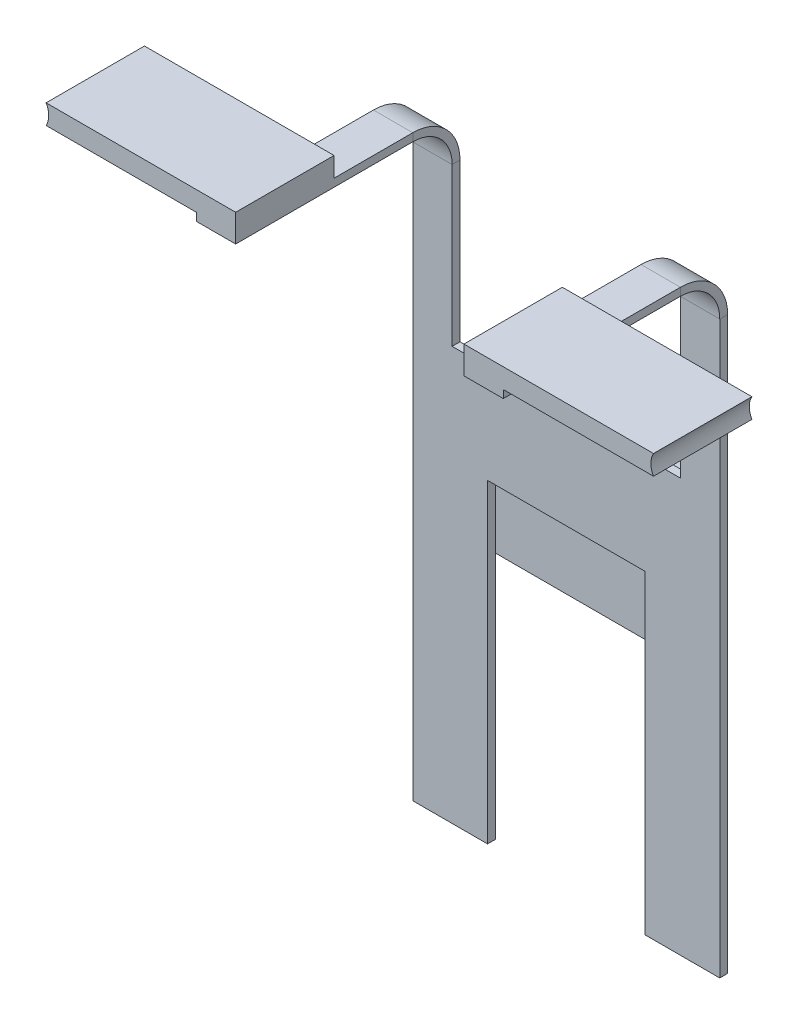
from build123d import *

# Parameters (mm, degrees)
EXTRUDE_1_DEPTH     = 4
SKETCH_2_W          = 100
SKETCH_2_H          = 72
EXTRUDE_2_DEPTH     = 20
SKETCH_4_W          = 20
SKETCH_4_H          = 4
SKETCH_7_W          = 50
SKETCH_7_H          = 10
SKETCH_9_W          = 50
SKETCH_9_H          = 10
SKETCH_12_R         = 10
CUT_EXTRUDE_1_DEPTH = 265.227174984


with BuildPart() as part:
    # 草图1 → 凸台-拉伸1 (new body)
    with BuildSketch(Plane.XY):
        Polygon((-40, 0), (40, 0), (40, -160), (78, -160), (78, 0), (78, 50), (-78, 50), (-78, 0), (-78, -160), (-40, -160), align=None)
    extrude(amount=EXTRUDE_1_DEPTH)

    # 草图2 → 凸台-拉伸2 (add)
    with BuildSketch(Plane(origin=(0, 0, 0), x_dir=(-1, 0, 0), z_dir=(0, 0, -1))):
        with Locations((0, 2)):
            Rectangle(SKETCH_2_W, SKETCH_2_H)
    extrude(amount=EXTRUDE_2_DEPTH)

    # 扫描1: sweep along a path in 草图5
    with BuildLine(Plane.ZY.offset(78)) as sweep_1_path:
        Line((0, 50), (0, 130))
        ThreePointArc((0, 130), (7.029437252, 146.970562748), (24, 154))
        Line((24, 154), (114, 154))
    # 草图4 → 扫描1 (sweep)
    with BuildSketch(Plane(origin=(0, 50, 0), x_dir=(1, 0, 0), z_dir=(0, 1, 0))):
        with Locations((-68, -2)):
            Rectangle(SKETCH_4_W, SKETCH_4_H)
        with Locations((68, -2)):
            Rectangle(SKETCH_4_W, SKETCH_4_H)
    sweep(path=sweep_1_path.line)

    # 扫描2: sweep along a path in 草图8
    with BuildLine(Plane.XY.offset(114)) as sweep_2_path:
        Line((-58, 154), (-158, 154))
    # 草图7 → 扫描2 (sweep)
    with BuildSketch(Plane(origin=(-58, 0, 0), x_dir=(0, 0, -1), z_dir=(1, 0, 0))):
        with Locations((-89, 159)):
            Rectangle(SKETCH_7_W, SKETCH_7_H)
    sweep(path=sweep_2_path.line)

    # 扫描3: sweep along a path in 草图10
    with BuildLine(Plane.XY.offset(114)) as sweep_3_path:
        Line((58, 154), (158, 154))
    # 草图9 → 扫描3 (sweep)
    with BuildSketch(Plane.ZY.offset(-58)):
        with Locations((89, 159)):
            Rectangle(SKETCH_9_W, SKETCH_9_H)
    sweep(path=sweep_3_path.line)

    # 草图12 → 切除-拉伸1 (cut, through all)
    with BuildSketch(Plane.XY.offset(114)):
        with Locations((-163, 159)):
            Circle(SKETCH_12_R)
        with Locations((163, 159)):
            Circle(SKETCH_12_R)
    extrude(amount=-CUT_EXTRUDE_1_DEPTH, mode=Mode.SUBTRACT)


solid = part.part
